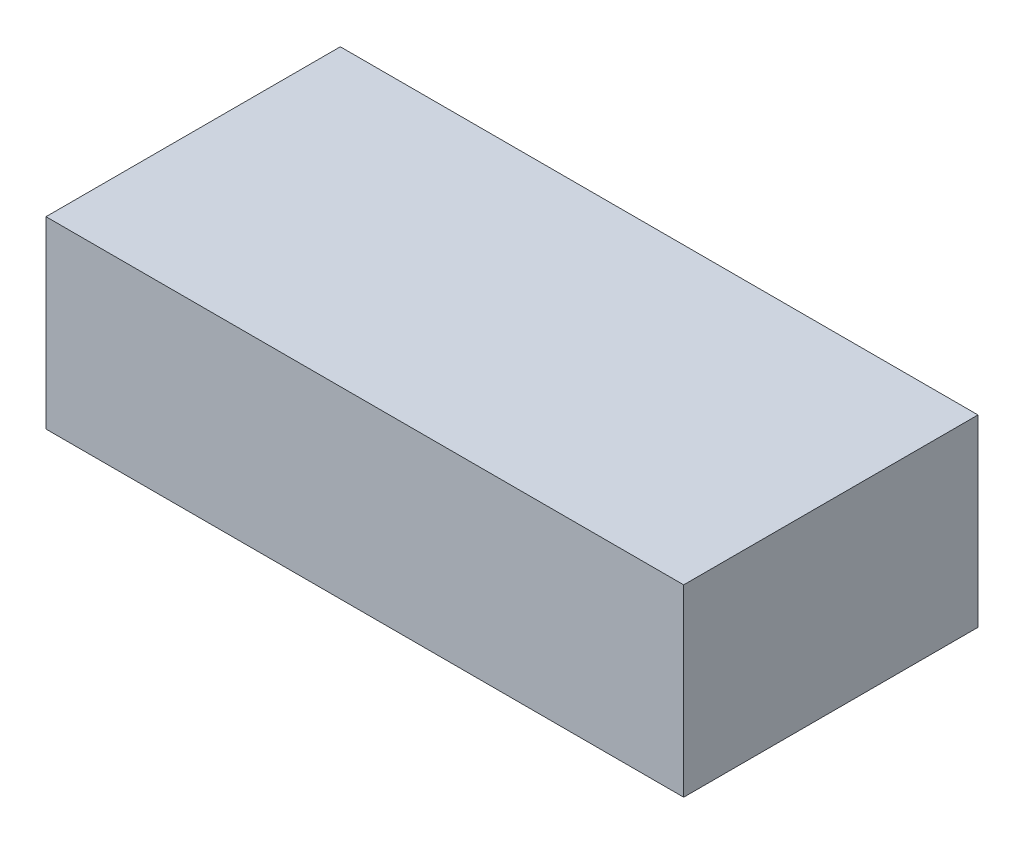
from build123d import *

# Parameters (mm, degrees)
SKETCH1_W           = 52
SKETCH1_H           = 24
BOSS_EXTRUDE1_DEPTH = 15


with BuildPart() as part:
    # Sketch1 → Boss-Extrude1 (new body)
    with BuildSketch(Plane(origin=(0, 0, 0), x_dir=(1, 0, 0), z_dir=(0, 1, 0))):
        Rectangle(SKETCH1_W, SKETCH1_H)
    extrude(amount=BOSS_EXTRUDE1_DEPTH)


solid = part.part
